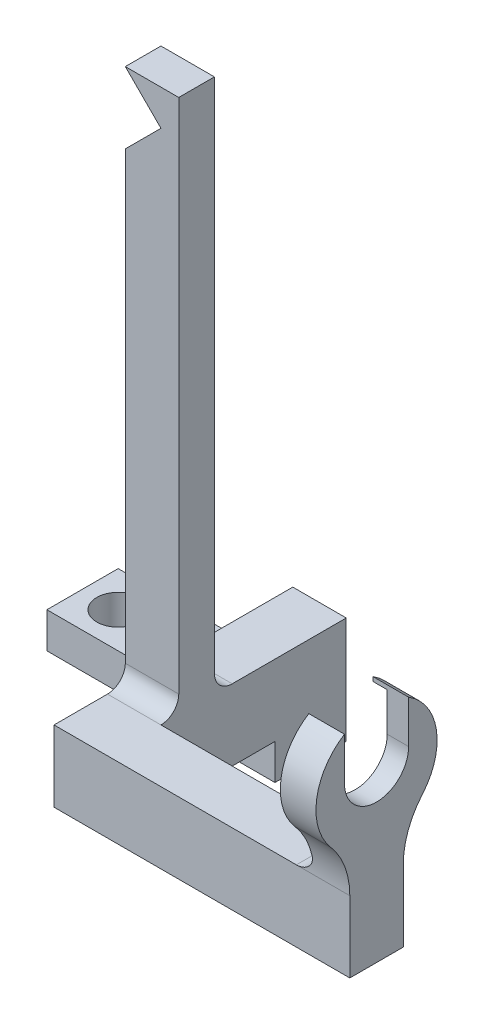
from build123d import *

# Parameters (mm, degrees)
SKETCH2_W                            = 22
SKETCH2_H                            = 10
SKETCH2_R                            = 3
BOSS_EXTRUDE1_DEPTH                  = 5
SKETCH3_W                            = 10
SKETCH3_H                            = 5
BOSS_EXTRUDE2_DEPTH                  = 10
BOSS_EXTRUDE3_DEPTH                  = 10
SKETCH5_W                            = 7.5
SKETCH5_H                            = 5
BOSS_EXTRUDE4_DEPTH                  = 75
CUT_EXTRUDE1_REACH                   = 98.857
BOSS_EXTRUDE5_DEPTH                  = 10
SKETCH13_W                           = 5
SKETCH13_H                           = 10
BOSS_EXTRUDE6_DEPTH                  = 7.5
BOSS_EXTRUDE7_DEPTH                  = 5
CUT_EXTRUDE5_REACH                   = 118.454
SKETCH16_R                           = 8
CUT_EXTRUDE6_DEPTH                   = 2
BOSS_EXTRUDE8_REACH                  = 104.314
BOSS_EXTRUDE8_END_RADIUS             = 11.091410312
BOSS_EXTRUDE8_DIRECTION_2_REACH      = 104.314
BOSS_EXTRUDE8_DIRECTION_2_END_RADIUS = 11.091410312
BOSS_EXTRUDE9_DEPTH                  = 7.5
BOSS_EXTRUDE10_START                 = -10
BOSS_EXTRUDE10_DEPTH                 = 10


with BuildPart() as part:
    # Sketch2 → Boss-Extrude1 (new body)
    with BuildSketch(Plane(origin=(0, 0, 0), x_dir=(1, 0, 0), z_dir=(0, 1, 0))):
        with Locations((6, 0)):
            Rectangle(SKETCH2_W, SKETCH2_H)
        with Locations(Location((0, 0, 0), (0, 0, 270))):
            Circle(SKETCH2_R, mode=Mode.SUBTRACT)
        with Locations(Location((12, 0, 0), (0, 0, 270))):
            Circle(SKETCH2_R, mode=Mode.SUBTRACT)
    extrude(amount=BOSS_EXTRUDE1_DEPTH)

    # Sketch3 → Boss-Extrude2 (add)
    with BuildSketch(Plane.XY.offset(5)):
        with Locations((22, 2.5)):
            Rectangle(SKETCH3_W, SKETCH3_H)
    extrude(amount=-BOSS_EXTRUDE2_DEPTH)

    # Sketch4 → Boss-Extrude3 (add)
    with BuildSketch(Plane(origin=(0, 5, 0), x_dir=(1, 0, 0), z_dir=(0, 1, 0))):
        Polygon((27, 5), (27, -5), (27, -7.5), (27, -18.5), (19.5, -18.5), (19.5, -7.5), (19.5, 5), align=None)
    extrude(amount=BOSS_EXTRUDE3_DEPTH)

    # Sketch5 → Boss-Extrude4 (add)
    with BuildSketch(Plane(origin=(0, 15, 0), x_dir=(1, 0, 0), z_dir=(0, 1, 0))):
        with Locations((23.25, -16)):
            Rectangle(SKETCH5_W, SKETCH5_H)
    extrude(amount=BOSS_EXTRUDE4_DEPTH)

    # Sketch6 → Cut-Extrude1 (cut, up to next)
    with BuildSketch(Plane.XY.offset(18.5), mode=Mode.PRIVATE) as cut_extrude1_sk1:
        Polygon((19.5, 90), (24.5, 85), (19.5, 80), align=None)
    cut_extrude1_tool1 = extrude(cut_extrude1_sk1.sketch, amount=-CUT_EXTRUDE1_REACH, mode=Mode.PRIVATE) & part.part
    add(cut_extrude1_tool1.solids().sort_by_distance((21.166667, 85, 18.5))[0], mode=Mode.SUBTRACT)

    # Sketch7 → Boss-Extrude5 (add)
    with BuildSketch(Plane(origin=(0, 15, 0), x_dir=(1, 0, 0), z_dir=(0, 1, 0))):
        Polygon((19.5, 5), (19.5, -28.5), (56, -28.5), (56, -21), (27, -21), (27, 5), align=None)
    extrude(amount=-BOSS_EXTRUDE5_DEPTH)

    # Sketch13 → Boss-Extrude6 (add)
    with BuildSketch(Plane(origin=(0, 0, 21), x_dir=(-1, 0, 0), z_dir=(0, 0, -1))):
        with Locations((-58.5, 10)):
            Rectangle(SKETCH13_W, SKETCH13_H)
    extrude(amount=-BOSS_EXTRUDE6_DEPTH)

    # Sketch14 → Boss-Extrude7 (add)
    with BuildSketch(Plane(origin=(61, 0, 0), x_dir=(0, 0, -1), z_dir=(1, 0, 0))):
        with BuildLine():
            Line((-29.25, 35), (-20.25, 35))
            ThreePointArc((-20.25, 35), (-16.346490099, 29.066011911), (-18.310852147, 22.240260236))
            ThreePointArc((-18.310852147, 22.240260236), (-20.306000981, 18.86176399), (-21, 15))
            Line((-21, 15), (-28.5, 15))
            ThreePointArc((-28.5, 15), (-29.193999019, 18.86176399), (-31.189147853, 22.240260236))
            ThreePointArc((-31.189147853, 22.240260236), (-33.153509901, 29.066011911), (-29.25, 35))
        make_face()
    extrude(amount=-BOSS_EXTRUDE7_DEPTH)

    # Sketch15 → Cut-Extrude5 (cut, up to next)
    with BuildSketch(Plane(origin=(61, 0, 0), x_dir=(0, 0, -1), z_dir=(1, 0, 0)), mode=Mode.PRIVATE) as cut_extrude5_sk1:
        with BuildLine():
            Line((-29.25, 35), (-29.25, 29))
            ThreePointArc((-29.25, 29), (-24.75, 24.5), (-20.25, 29))
            Line((-20.25, 29), (-20.25, 35))
            Line((-20.25, 35), (-29.25, 35))
        make_face()
    cut_extrude5_tool1 = extrude(cut_extrude5_sk1.sketch, amount=-CUT_EXTRUDE5_REACH, mode=Mode.PRIVATE) & part.part
    add(cut_extrude5_tool1.solids().sort_by_distance((61, 30.179951, 24.75))[0], mode=Mode.SUBTRACT)

    # Sketch16 → Cut-Extrude6 (cut)
    with BuildSketch(Plane(origin=(56, 0, 0), x_dir=(0, 0, -1), z_dir=(1, 0, 0))):
        with Locations((-24.75, 27.788897449)):
            Circle(SKETCH16_R)
    extrude(amount=CUT_EXTRUDE6_DEPTH, mode=Mode.SUBTRACT)

    # Boss-Extrude8: up to this cylinder (the profile starts outside it)
    boss_extrude8_end = Plane(origin=(55.44158, 15, 9.908589688), z_dir=(1, 0, 0)) * Cylinder(BOSS_EXTRUDE8_END_RADIUS, 231.810820624, mode=Mode.PRIVATE)
    # Sketch17 → Boss-Extrude8 (add, up to the surface)
    with BuildSketch(Plane(origin=(56, 15, 28.5), x_dir=(-1, 0, 0), z_dir=(0, 0, -1)), mode=Mode.PRIVATE) as boss_extrude8_sk1:
        with BuildLine():
            Line((0, 0), (0, 2.5))
            ThreePointArc((0, 2.5), (0.732233047, 0.732233047), (2.5, 0))
            Line((2.5, 0), (0, 0))
        make_face()
    boss_extrude8_tool1 = extrude(boss_extrude8_sk1.sketch, amount=BOSS_EXTRUDE8_REACH, mode=Mode.PRIVATE) - boss_extrude8_end
    add(boss_extrude8_tool1.solids().sort_by_distance((55.44158, 15.55842, 28.5))[0])

    # Boss-Extrude8 direction 2: up to this cylinder (the profile starts outside it)
    boss_extrude8_direction_2_end = Plane(origin=(55.44158, 15, 39.591410312), z_dir=(1, 0, 0)) * Cylinder(BOSS_EXTRUDE8_DIRECTION_2_END_RADIUS, 231.810820624, mode=Mode.PRIVATE)
    # Sketch17 → Boss-Extrude8 direction 2 (add, up to the surface)
    with BuildSketch(Plane(origin=(56, 15, 28.5), x_dir=(-1, 0, 0), z_dir=(0, 0, -1)), mode=Mode.PRIVATE) as boss_extrude8_direction_2_sk1:
        with BuildLine():
            Line((0, 0), (0, 2.5))
            ThreePointArc((0, 2.5), (0.732233047, 0.732233047), (2.5, 0))
            Line((2.5, 0), (0, 0))
        make_face()
    boss_extrude8_direction_2_tool1 = extrude(boss_extrude8_direction_2_sk1.sketch, amount=-BOSS_EXTRUDE8_DIRECTION_2_REACH, mode=Mode.PRIVATE) - boss_extrude8_direction_2_end
    add(boss_extrude8_direction_2_tool1.solids().sort_by_distance((55.44158, 15.55842, 28.5))[0])

    # Sketch18 → Boss-Extrude9 (add)
    with BuildSketch(Plane(origin=(27, 0, 0), x_dir=(0, 0, -1), z_dir=(1, 0, 0))):
        with BuildLine():
            Line((-13.5, 15), (-13.5, 17.5))
            ThreePointArc((-13.5, 17.5), (-12.767766953, 15.732233047), (-11, 15))
            Line((-11, 15), (-13.5, 15))
        make_face()
        with BuildLine():
            Line((-18.5, 15), (-18.5, 17.5))
            ThreePointArc((-18.5, 17.5), (-19.232233047, 15.732233047), (-21, 15))
            Line((-21, 15), (-18.5, 15))
        make_face()
    extrude(amount=-BOSS_EXTRUDE9_DEPTH)

    # Sketch19 → Boss-Extrude10 (add)
    with BuildSketch(Plane(origin=(0, 0, -5), x_dir=(-1, 0, 0), z_dir=(0, 0, -1)).offset(BOSS_EXTRUDE10_START)):
        with BuildLine():
            Line((-19.5, 5), (-19.5, 9.5))
            ThreePointArc((-19.5, 9.5), (-18.181980515, 6.318019485), (-15, 5))
            Line((-15, 5), (-19.5, 5))
        make_face()
    extrude(amount=BOSS_EXTRUDE10_DEPTH)


solid = part.part
